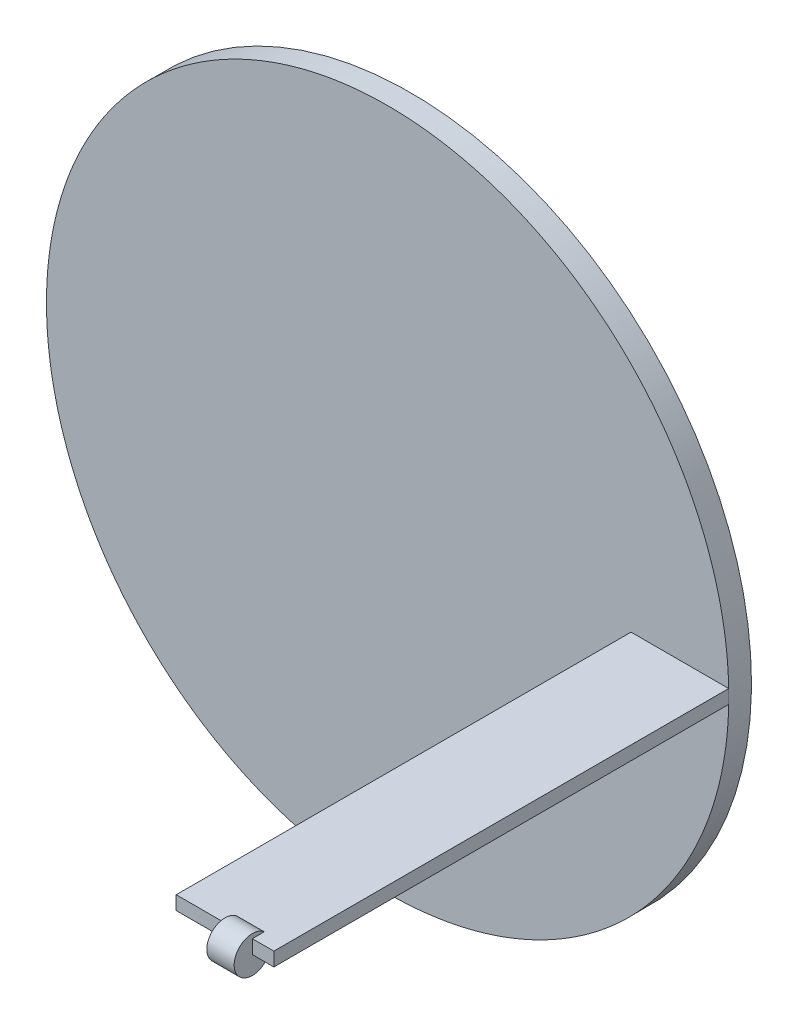
from build123d import *

# Parameters (mm, degrees)
ESBO_O1_R                  = 75
RESSALTO_EXTRUS_O1_DEPTH   = 5
ESBO_O2_R                  = 10
RESSALTO_EXTRUS_O2_DEPTH   = 30
ESBO_O4_W                  = 21.468474511
ESBO_O4_H                  = 3.02321723
RESSALTO_EXTRUS_O3_DEPTH   = 100
SMLINK_BETA_CIRCLE_R       = 4
SMLINK_BETA_CYLINDER_DEPTH = 6
SMLINK_PSI_CIRCLE_R        = 4
SMLINK_PSI_CYLINDER_DEPTH  = 6


with BuildPart() as part:
    # Esboço1 → Ressalto-extrusão1 (new body)
    with BuildSketch(Plane(origin=(0, 0, 0), x_dir=(0, 1, 0), z_dir=(0, 0, 1))):
        with Locations(Location((0, 0, 0), (0, 0, 270))):
            Circle(ESBO_O1_R)
    extrude(amount=RESSALTO_EXTRUS_O1_DEPTH)

    # Esboço2 → Ressalto-extrusão2 (add)
    with BuildSketch(Plane.XY.offset(5)):
        Circle(ESBO_O2_R)
    extrude(amount=-RESSALTO_EXTRUS_O2_DEPTH)

    # Esboço4 → Ressalto-extrusão3 (add)
    with BuildSketch(Plane.XY.offset(5)):
        with Locations((64.250395504, -0.006564625)):
            Rectangle(ESBO_O4_W, ESBO_O4_H)
    extrude(amount=RESSALTO_EXTRUS_O3_DEPTH)


with BuildPart() as body_2:
    # SMLINK_BETA_CIRCLE → SMLINK_BETA_CYLINDER (new body)
    with BuildSketch(Plane(origin=(0, 0, -25), x_dir=(0, 1, 0), z_dir=(0, 0, 1))):
        with Locations(Location((0, 0, 0), (0, 0, 270))):
            Circle(SMLINK_BETA_CIRCLE_R)
    extrude(amount=-SMLINK_BETA_CYLINDER_DEPTH)


with BuildPart() as body_3:
    # SMLINK_PSI_CIRCLE → SMLINK_PSI_CYLINDER (new body)
    with BuildSketch(Plane.YZ.offset(64.250395504)):
        with Locations(Location((-1.51817324, 105, 0), (0, 0, 270))):
            Circle(SMLINK_PSI_CIRCLE_R)
    extrude(amount=SMLINK_PSI_CYLINDER_DEPTH)


solid = Compound([part.part, body_2.part, body_3.part])
